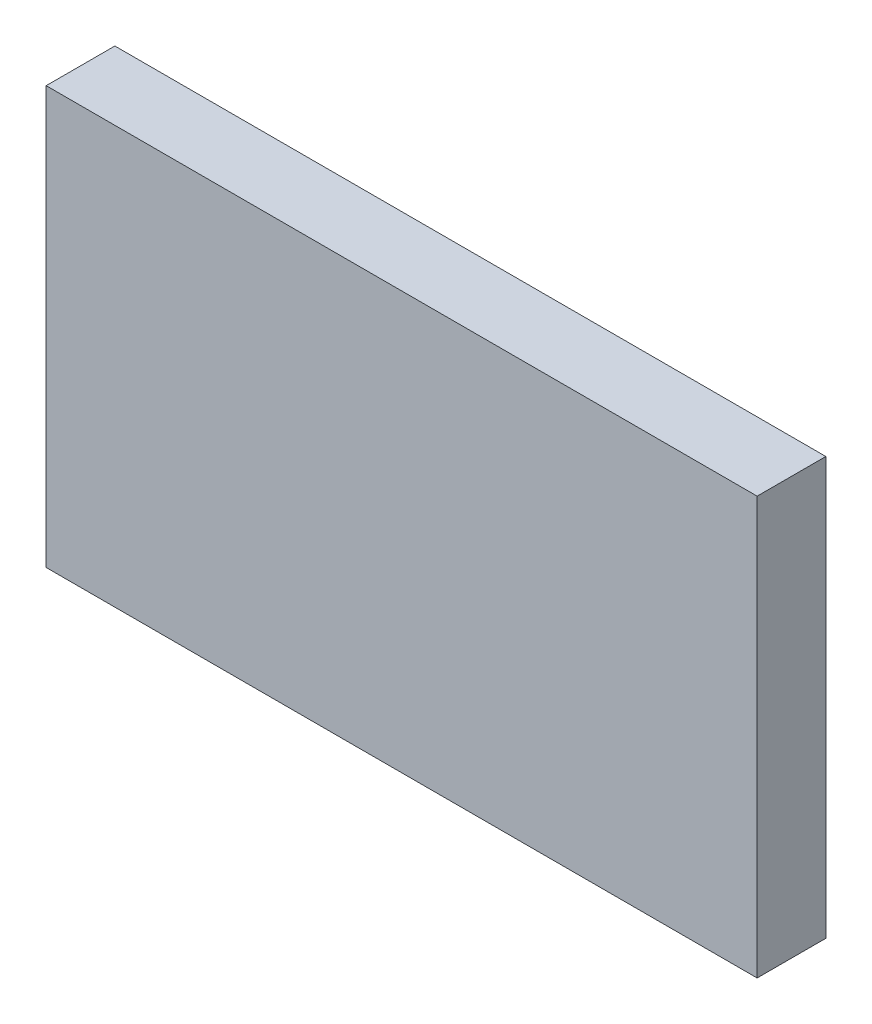
from build123d import *

# Parameters (mm, degrees)
SKETCH1_W           = 41.4
SKETCH1_H           = 24.3
BOSS_EXTRUDE1_DEPTH = 4
SKETCH2_W           = 24
SKETCH2_H           = 0.3
BOSS_EXTRUDE2_DEPTH = 3


with BuildPart() as part:
    # Sketch1 → Boss-Extrude1 (new body)
    with BuildSketch(Plane.XY):
        Rectangle(SKETCH1_W, SKETCH1_H)
    extrude(amount=-BOSS_EXTRUDE1_DEPTH)

    # Sketch2 → Boss-Extrude2 (add)
    with BuildSketch(Plane(origin=(0, 0, -4), x_dir=(-1, 0, 0), z_dir=(0, 0, -1))):
        with Locations((0, -11.55)):
            Rectangle(SKETCH2_W, SKETCH2_H)
    extrude(amount=BOSS_EXTRUDE2_DEPTH)


solid = part.part
